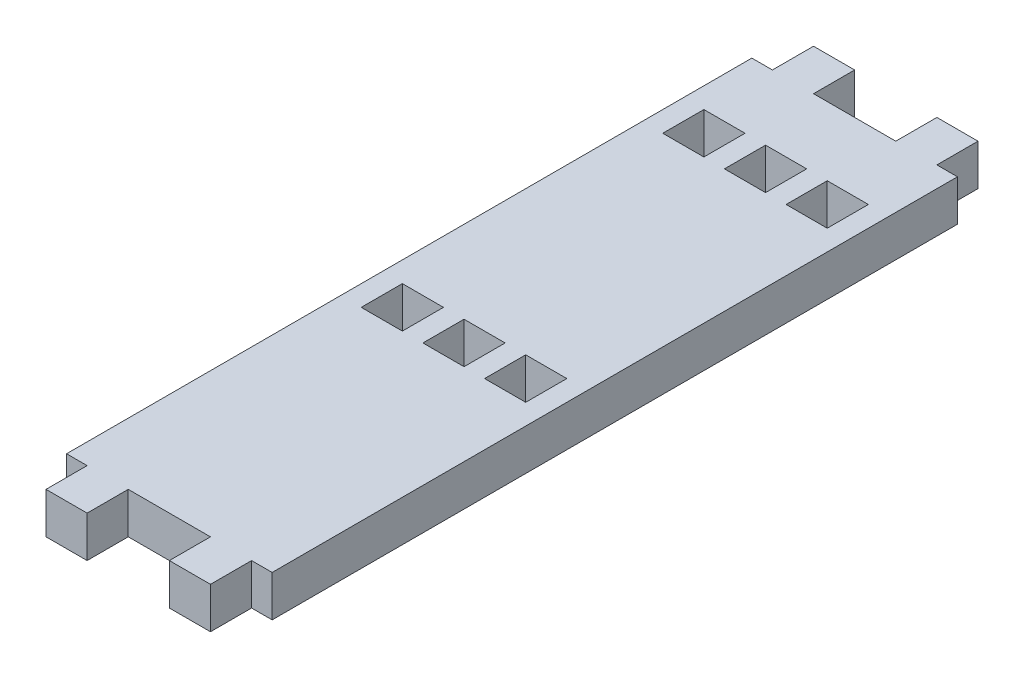
from build123d import *

# Parameters (mm, degrees)
SKETCH1_W           = 6
SKETCH1_H           = 6
BOSS_EXTRUDE2_DEPTH = 6


with BuildPart() as part:
    # Sketch1 → Boss-Extrude2 (new body)
    with BuildSketch(Plane(origin=(0, 0, 0), x_dir=(1, 0, 0), z_dir=(0, 1, 0))):
        Polygon((0, 0), (-3, 0), (-3, 6), (-9, 6), (-9, 0), (-21, 0), (-21, 6), (-27, 6), (-27, 0), (-30, 0), (-30, -100), (-27, -100), (-27, -106), (-21, -106), (-21, -100), (-9, -100), (-9, -106), (-3, -106), (-3, -100), (0, -100), align=None)
        with Locations((-15, -57)):
            Rectangle(SKETCH1_W, SKETCH1_H, mode=Mode.SUBTRACT)
        with Locations((-6, -57)):
            Rectangle(SKETCH1_W, SKETCH1_H, mode=Mode.SUBTRACT)
        with Locations((-24, -57)):
            Rectangle(SKETCH1_W, SKETCH1_H, mode=Mode.SUBTRACT)
        with Locations((-15, -13)):
            Rectangle(SKETCH1_W, SKETCH1_H, mode=Mode.SUBTRACT)
        with Locations((-6, -13)):
            Rectangle(SKETCH1_W, SKETCH1_H, mode=Mode.SUBTRACT)
        with Locations((-24, -13)):
            Rectangle(SKETCH1_W, SKETCH1_H, mode=Mode.SUBTRACT)
    extrude(amount=BOSS_EXTRUDE2_DEPTH)


solid = part.part
